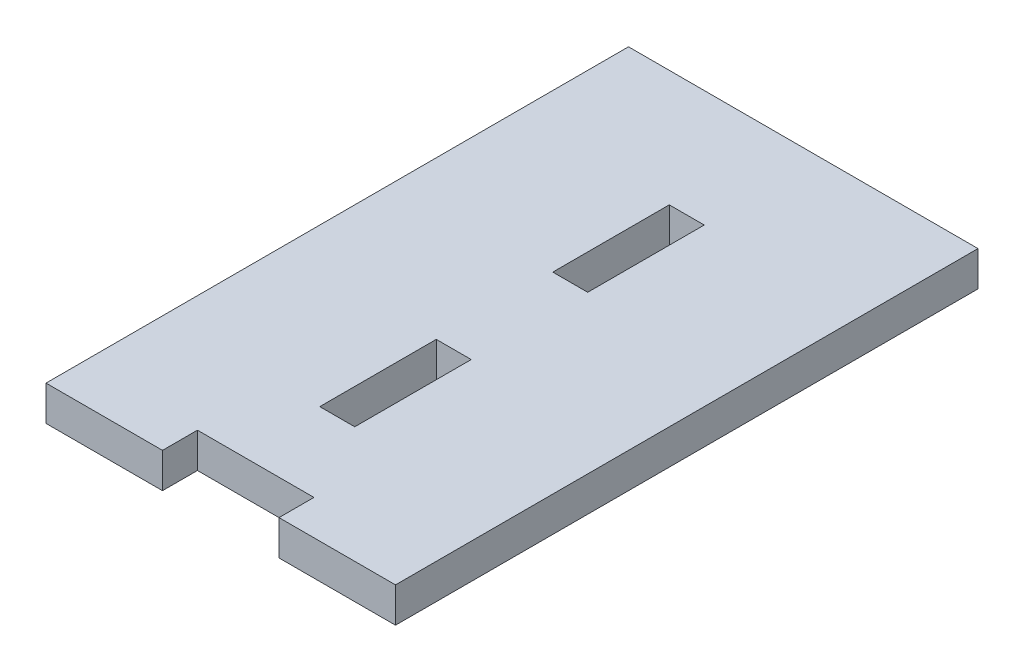
from build123d import *

# Parameters (mm, degrees)
CROQUIS1_W              = 3
CROQUIS1_H              = 10
SALIENTE_EXTRUIR1_DEPTH = 3


with BuildPart() as part:
    # Croquis1 → Saliente-Extruir1 (new body)
    with BuildSketch(Plane(origin=(0, 0, 0), x_dir=(1, 0, 0), z_dir=(0, 1, 0))):
        Polygon((25, 0), (35, 0), (35, 50), (5, 50), (5, 0), (15, 0), (15, 3), (25, 3), align=None)
        with Locations((20, 15)):
            Rectangle(CROQUIS1_W, CROQUIS1_H, mode=Mode.SUBTRACT)
        with Locations((20, 35)):
            Rectangle(CROQUIS1_W, CROQUIS1_H, mode=Mode.SUBTRACT)
    extrude(amount=SALIENTE_EXTRUIR1_DEPTH)


solid = part.part
